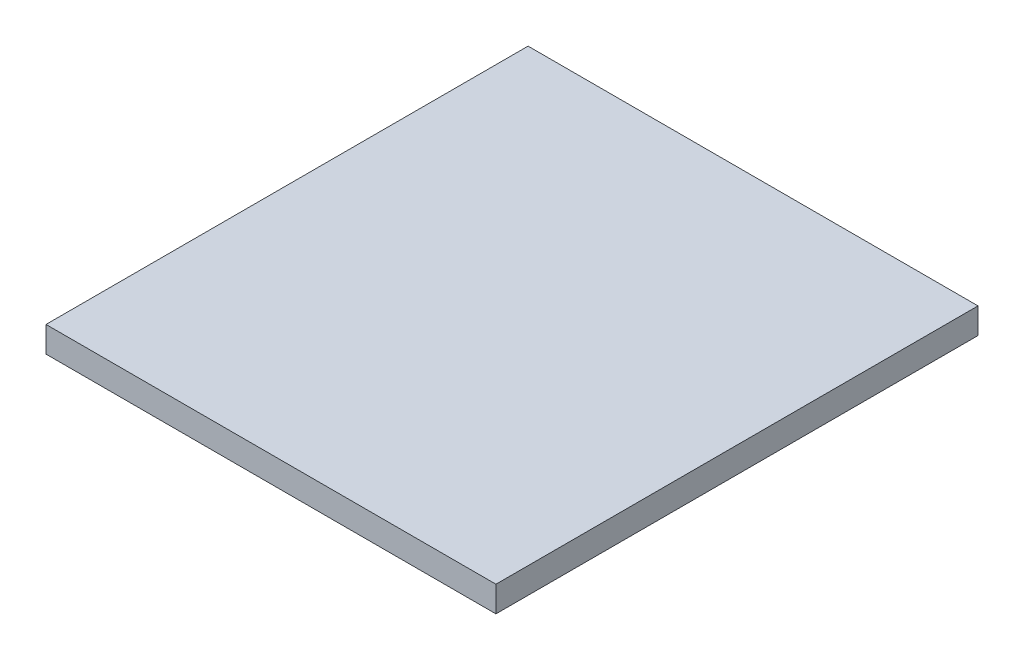
from build123d import *

# Parameters (mm, degrees)
SKETCH1_W           = 35
SKETCH1_H           = 37.5
BOSS_EXTRUDE1_DEPTH = 2


with BuildPart() as part:
    # Sketch1 → Boss-Extrude1 (new body)
    with BuildSketch(Plane(origin=(0, 0, 0), x_dir=(1, 0, 0), z_dir=(0, 1, 0))):
        Rectangle(SKETCH1_W, SKETCH1_H)
    extrude(amount=BOSS_EXTRUDE1_DEPTH)


solid = part.part
